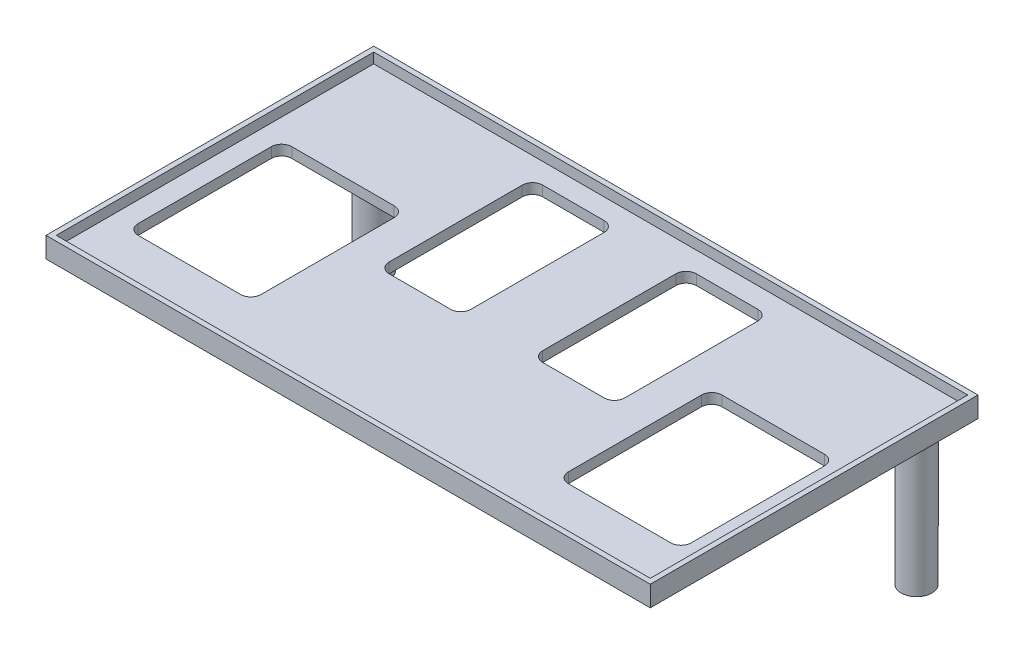
from build123d import *

# Parameters (mm, degrees)
SKIZZE1_W                       = 59
SKIZZE1_H                       = 32
AUFSATZ_LINEAR_AUSTRAGEN1_DEPTH = 1
SKIZZE3_W                       = 59
SKIZZE3_H                       = 32
SKIZZE3_W_2                     = 58
SKIZZE3_H_2                     = 31
AUFSATZ_LINEAR_AUSTRAGEN2_DEPTH = 1
SKIZZE4_R                       = 1.55
AUFSATZ_LINEAR_AUSTRAGEN3_DEPTH = 1.5
SKIZZE5_R                       = 1.5
AUFSATZ_LINEAR_AUSTRAGEN4_DEPTH = 14
VERRUNDUNG3_R                   = 1
SCHNITT_LINEAR_AUSTRAGEN2_DEPTH = 1


with BuildPart() as part:
    # Skizze1 → Aufsatz-Linear austragen1 (new body)
    with BuildSketch(Plane(origin=(0, 0, 0), x_dir=(1, 0, 0), z_dir=(0, 1, 0))):
        Rectangle(SKIZZE1_W, SKIZZE1_H)
    extrude(amount=AUFSATZ_LINEAR_AUSTRAGEN1_DEPTH)

    # Skizze3 → Aufsatz-Linear austragen2 (add)
    with BuildSketch(Plane(origin=(0, 1, 0), x_dir=(1, 0, 0), z_dir=(0, 1, 0))):
        Rectangle(SKIZZE3_W, SKIZZE3_H)
        Rectangle(SKIZZE3_W_2, SKIZZE3_H_2, mode=Mode.SUBTRACT)
    extrude(amount=AUFSATZ_LINEAR_AUSTRAGEN2_DEPTH)

    # Skizze4 → Aufsatz-Linear austragen3 (add)
    with BuildSketch(Plane.XZ):
        with Locations(Location((8, 6, 0), (0, 0, 90))):
            Circle(SKIZZE4_R)
        with Locations(Location((-8, 6, 0), (0, 0, 90))):
            Circle(SKIZZE4_R)
    extrude(amount=AUFSATZ_LINEAR_AUSTRAGEN3_DEPTH)

    # Skizze5 → Aufsatz-Linear austragen4 (add)
    with BuildSketch(Plane.XZ):
        with Locations(Location((26.5, -13, 0), (0, 0, 90))):
            Circle(SKIZZE5_R)
        with Locations(Location((-26.5, -13, 0), (0, 0, 90))):
            Circle(SKIZZE5_R)
    extrude(amount=AUFSATZ_LINEAR_AUSTRAGEN4_DEPTH)

    # Verrundung3
    verrundung3_edges = [part.edges().sort_by_distance(p)[0] for p in [
        (26.5, 0, -14.5),
        (-26.5, 0, -14.5),
    ]]
    fillet(verrundung3_edges, radius=VERRUNDUNG3_R)

    # Skizze6 → Schnitt-Linear austragen2 (cut)
    with BuildSketch(Plane.XZ):
        with BuildLine():
            Line((16, 10.5), (26, 10.5))
            ThreePointArc((26, 10.5), (26.707106781, 10.207106781), (27, 9.5))
            Line((27, 9.5), (27, -3.5))
            ThreePointArc((27, -3.5), (26.707106781, -4.207106781), (26, -4.5))
            Line((26, -4.5), (16, -4.5))
            ThreePointArc((16, -4.5), (15.292893219, -4.207106781), (15, -3.5))
            Line((15, -3.5), (15, 9.5))
            ThreePointArc((15, 9.5), (15.292893219, 10.207106781), (16, 10.5))
        make_face()
        with BuildLine():
            Line((4.5, 1.5), (10.5, 1.5))
            ThreePointArc((10.5, 1.5), (11.207106781, 1.207106781), (11.5, 0.5))
            Line((11.5, 0.5), (11.5, -12.5))
            ThreePointArc((11.5, -12.5), (11.207106781, -13.207106781), (10.5, -13.5))
            Line((10.5, -13.5), (4.5, -13.5))
            ThreePointArc((4.5, -13.5), (3.792893219, -13.207106781), (3.5, -12.5))
            Line((3.5, -12.5), (3.5, 0.5))
            ThreePointArc((3.5, 0.5), (3.792893219, 1.207106781), (4.5, 1.5))
        make_face()
        with BuildLine():
            Line((-11.5, 0.5), (-11.5, -12.5))
            ThreePointArc((-11.5, -12.5), (-11.207106781, -13.207106781), (-10.5, -13.5))
            Line((-10.5, -13.5), (-4.5, -13.5))
            ThreePointArc((-4.5, -13.5), (-3.792893219, -13.207106781), (-3.5, -12.5))
            Line((-3.5, -12.5), (-3.5, 0.5))
            ThreePointArc((-3.5, 0.5), (-3.792893219, 1.207106781), (-4.5, 1.5))
            Line((-4.5, 1.5), (-10.5, 1.5))
            ThreePointArc((-10.5, 1.5), (-11.207106781, 1.207106781), (-11.5, 0.5))
        make_face()
        with BuildLine():
            Line((-27, 9.5), (-27, -3.5))
            ThreePointArc((-27, -3.5), (-26.707106781, -4.207106781), (-26, -4.5))
            Line((-26, -4.5), (-16, -4.5))
            ThreePointArc((-16, -4.5), (-15.292893219, -4.207106781), (-15, -3.5))
            Line((-15, -3.5), (-15, 9.5))
            ThreePointArc((-15, 9.5), (-15.292893219, 10.207106781), (-16, 10.5))
            Line((-16, 10.5), (-26, 10.5))
            ThreePointArc((-26, 10.5), (-26.707106781, 10.207106781), (-27, 9.5))
        make_face()
    extrude(amount=-SCHNITT_LINEAR_AUSTRAGEN2_DEPTH, mode=Mode.SUBTRACT)


solid = part.part
